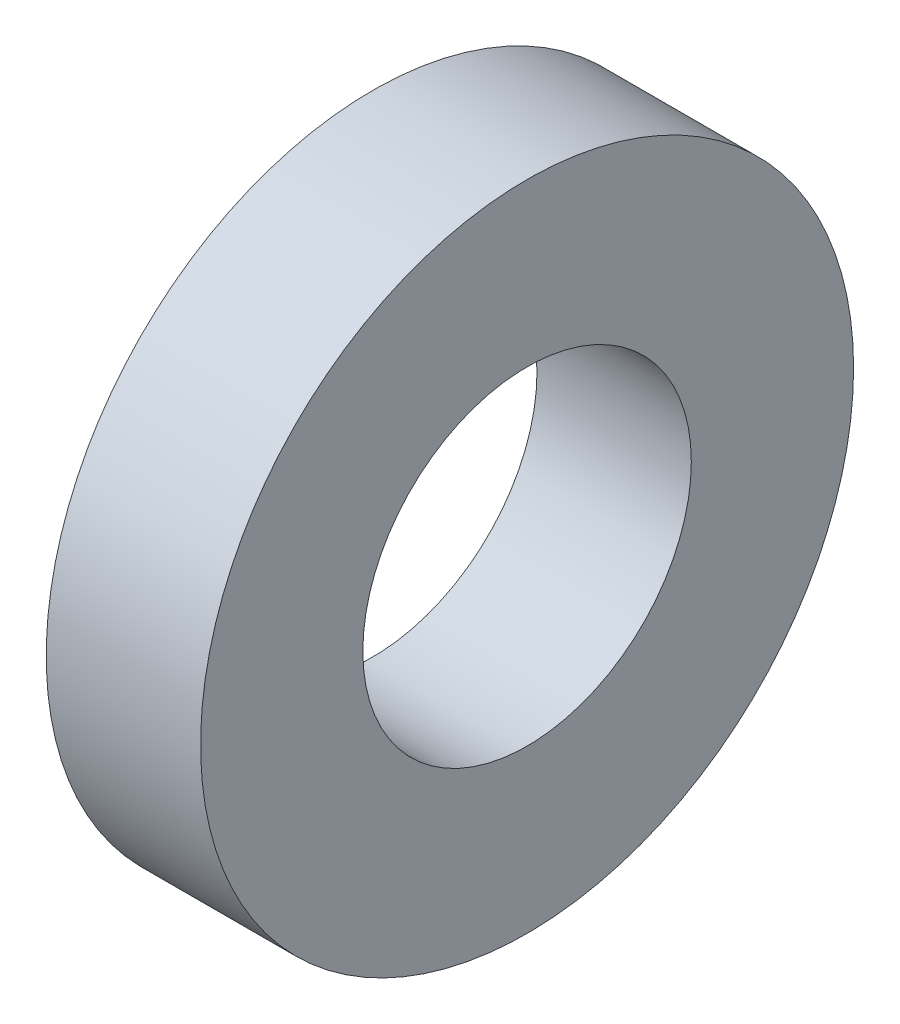
from build123d import *

# Parameters (mm, degrees)
SKETCH_1_R      = 8.25
SKETCH_1_R_2    = 4.15
EXTRUDE_1_DEPTH = 3.9


with BuildPart() as part:
    # 草图1 → 凸台-拉伸1 (new body)
    with BuildSketch(Plane(origin=(0, 0, 0), x_dir=(0, 0, -1), z_dir=(1, 0, 0))):
        Circle(SKETCH_1_R)
        Circle(SKETCH_1_R_2, mode=Mode.SUBTRACT)
    extrude(amount=EXTRUDE_1_DEPTH)


solid = part.part
